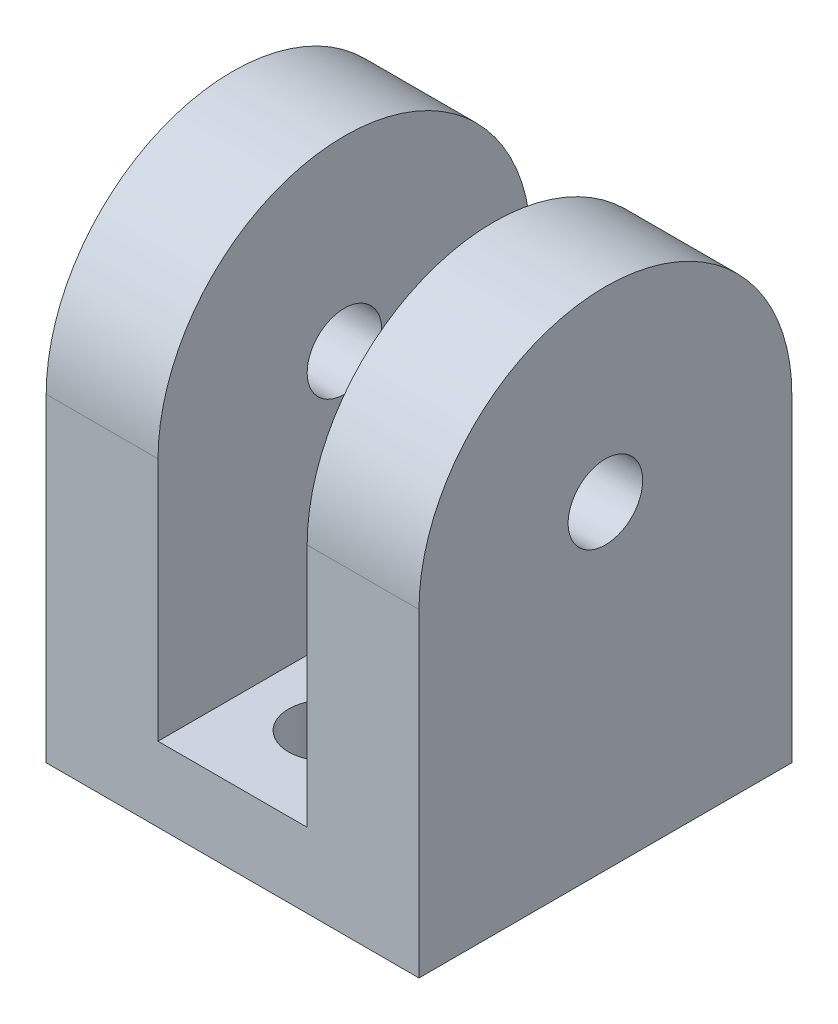
from build123d import *

# Parameters (mm, degrees)
SKETCH1_W              = 31.75
SKETCH1_H              = 31.75
BOSS_EXTRUDE1_DEPTH    = 50.8
CUT_EXTRUDE1_DEPTH     = 68.7994469
SKETCH3_W              = 12.7
SKETCH3_H              = 50.8
CUT_EXTRUDE2_DEPTH     = 63.206798736
F_1_1_DIAMETER_HOLE1_D = 6.35
F_1_1_DIAMETER_HOLE2_D = 6.35


with BuildPart() as part:
    # Sketch1 → Boss-Extrude1 (new body)
    with BuildSketch(Plane(origin=(0, 0, 0), x_dir=(1, 0, 0), z_dir=(0, 1, 0))):
        with Locations((15.875, 15.875)):
            Rectangle(SKETCH1_W, SKETCH1_H)
    extrude(amount=BOSS_EXTRUDE1_DEPTH)

    # Sketch2 → Cut-Extrude1 (cut, through all)
    with BuildSketch(Plane(origin=(31.75, 0, 0), x_dir=(0, 0, -1), z_dir=(1, 0, 0))):
        with BuildLine():
            Line((0, 50.8), (31.75, 50.8))
            Line((31.75, 50.8), (31.75, 27.178))
            ThreePointArc((31.75, 27.178), (15.875, 43.053), (0, 27.178))
            Line((0, 27.178), (0, 50.8))
        make_face()
    extrude(amount=-CUT_EXTRUDE1_DEPTH, mode=Mode.SUBTRACT)

    # Sketch3 → Cut-Extrude2 (cut, through all)
    with BuildSketch(Plane.XY):
        with Locations((15.875, 31.75)):
            Rectangle(SKETCH3_W, SKETCH3_H)
    extrude(amount=-CUT_EXTRUDE2_DEPTH, mode=Mode.SUBTRACT)

    # 1 (1) Diameter Hole1 (through all)
    with Locations(Plane(origin=(0, 6.35, 0), x_dir=(1, 0, 0), z_dir=(0, 1, 0))):
        with Locations((15.875, 23.8125), (15.875, 7.9375)):
            Hole(F_1_1_DIAMETER_HOLE1_D / 2)

    # 1 (1) Diameter Hole2 (through all)
    with Locations(Plane(origin=(31.75, 0, 0), x_dir=(0, 0, -1), z_dir=(1, 0, 0))):
        with Locations((15.875, 27.178)):
            Hole(F_1_1_DIAMETER_HOLE2_D / 2)


solid = part.part
